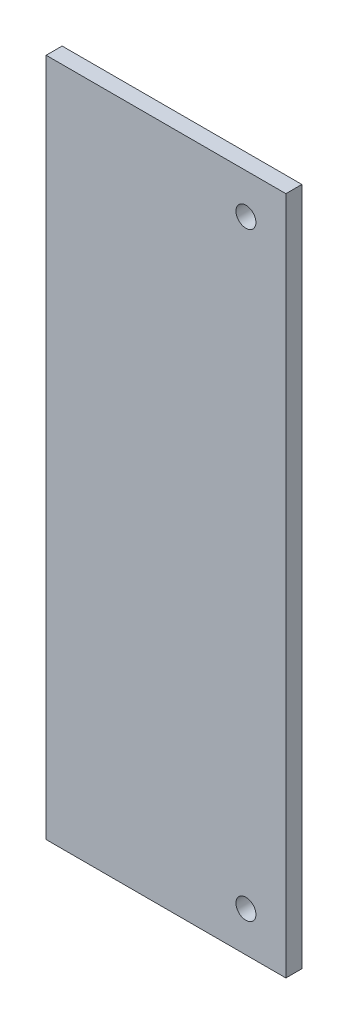
from build123d import *

# Parameters (mm, degrees)
SKETCH1_W           = 60
SKETCH1_H           = 170
BOSS_EXTRUDE1_DEPTH = 4
CUT_EXTRUDE1_REACH  = 182.322
SKETCH2_R           = 2.5


with BuildPart() as part:
    # Sketch1 → Boss-Extrude1 (new body)
    with BuildSketch(Plane.XY):
        with Locations((-30, 85)):
            Rectangle(SKETCH1_W, SKETCH1_H)
    extrude(amount=BOSS_EXTRUDE1_DEPTH)

    # Sketch2 → Cut-Extrude1 (cut, up to next)
    with BuildSketch(Plane(origin=(0, 0, 0), x_dir=(-1, 0, 0), z_dir=(0, 0, -1)), mode=Mode.PRIVATE) as cut_extrude1_sk1:
        with Locations((10, 10)):
            Circle(SKETCH2_R)
    cut_extrude1_tool1 = extrude(cut_extrude1_sk1.sketch, amount=-CUT_EXTRUDE1_REACH, mode=Mode.PRIVATE) & part.part
    # Sketch2 → Cut-Extrude1 (cut, up to next)
    with BuildSketch(Plane(origin=(0, 0, 0), x_dir=(-1, 0, 0), z_dir=(0, 0, -1)), mode=Mode.PRIVATE) as cut_extrude1_sk2:
        with Locations((10, 160)):
            Circle(SKETCH2_R)
    cut_extrude1_tool2 = extrude(cut_extrude1_sk2.sketch, amount=-CUT_EXTRUDE1_REACH, mode=Mode.PRIVATE) & part.part
    add(cut_extrude1_tool1.solids().sort_by_distance((-10, 10, 0))[0], mode=Mode.SUBTRACT)
    add(cut_extrude1_tool2.solids().sort_by_distance((-10, 160, 0))[0], mode=Mode.SUBTRACT)


solid = part.part
